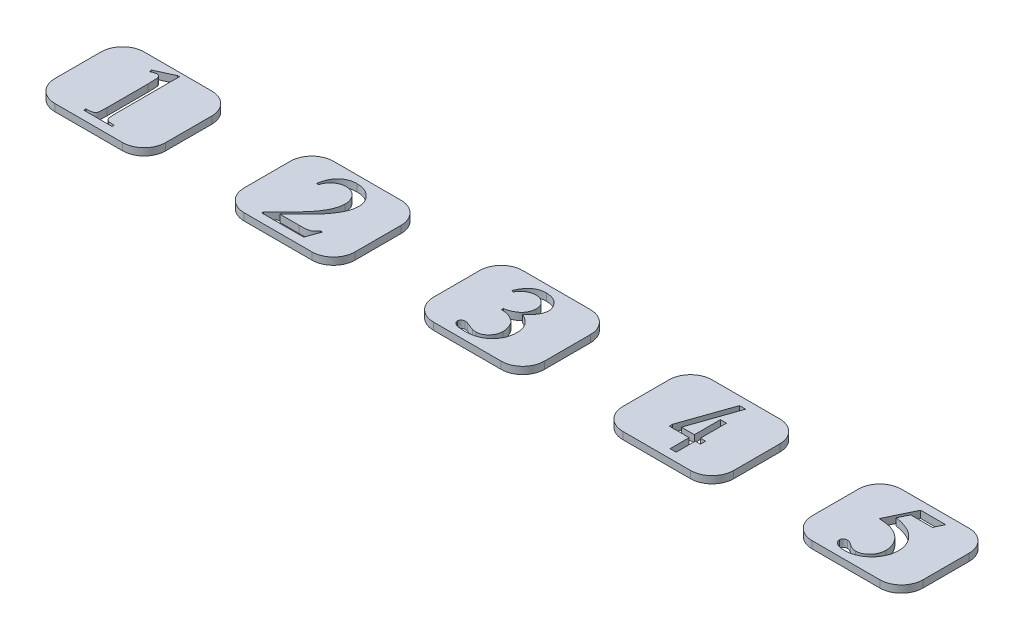
from build123d import *

# Parameters (mm, degrees)
BOSS_EXTRUDE2_DEPTH   = 1
BOSS_EXTRUDE2_2_DEPTH = 1
BOSS_EXTRUDE2_3_DEPTH = 1
BOSS_EXTRUDE2_4_DEPTH = 1
BOSS_EXTRUDE2_5_DEPTH = 1


with BuildPart() as part:
    # Sketch1 → Boss-Extrude2 (new body)
    with BuildSketch(Plane(origin=(0, 0, 0), x_dir=(1, 0, 0), z_dir=(0, 1, 0))):
        with BuildLine():
            Line((-74.96080402, -8.078643216), (-65.56080402, -8.078643216))
            ThreePointArc((-65.56080402, -8.078643216), (-63.439483677, -7.19996356), (-62.56080402, -5.078643216))
            Line((-62.56080402, -5.078643216), (-62.56080402, 1.321356784))
            ThreePointArc((-62.56080402, 1.321356784), (-63.439483677, 3.442677127), (-65.56080402, 4.321356784))
            Line((-65.56080402, 4.321356784), (-74.96080402, 4.321356784))
            ThreePointArc((-74.96080402, 4.321356784), (-77.082124364, 3.442677127), (-77.96080402, 1.321356784))
            Line((-77.96080402, 1.321356784), (-77.96080402, -5.078643216))
            ThreePointArc((-77.96080402, -5.078643216), (-77.082124364, -7.19996356), (-74.96080402, -8.078643216))
        make_face()
        with BuildLine():
            Line((-72.308324749, 2.627703027), (-69.792342246, 3.797714873))
            Line((-69.792342246, 3.797714873), (-69.529546617, 3.797714873))
            Line((-69.529546617, 3.797714873), (-69.529546617, -4.977373967))
            add(Edge.make_bspline(
                [(-69.529546617, -4.977373967), (-69.528639442, -5.049733103), (-69.526920574, -5.186835517), (-69.526703838, -5.38194185), (-69.517803674, -5.554735488), (-69.513462486, -5.706603583), (-69.500013951, -5.836597893), (-69.491105424, -5.94688009), (-69.474275743, -6.035021909), (-69.454746056, -6.124136325), (-69.414499417, -6.215248293), (-69.346230791, -6.309027449), (-69.25802298, -6.3889114), (-69.145749231, -6.461265811), (-68.990148641, -6.512079455), (-68.783962301, -6.551507397), (-68.518513713, -6.576882765), (-68.321500741, -6.582858072), (-68.213283291, -6.586140255)],
                knots=[0, 0, 0, 0, 1.356933168, 2.571048021, 3.657379777, 4.601012336, 5.418253307, 6.107533085, 6.673460353, 7.099554724, 7.815972102, 8.521630774, 9.259509655, 10.036179522, 11.007509208, 12.304408113, 13.970044684, 16, 16, 16, 16], degree=3))
            Line((-68.213283291, -6.586140255), (-68.213283291, -6.878643216))
            Line((-68.213283291, -6.878643216), (-72.162073269, -6.878643216))
            Line((-72.162073269, -6.878643216), (-72.162073269, -6.586140255))
            add(Edge.make_bspline(
                [(-72.162073269, -6.586140255), (-72.051552799, -6.583001689), (-71.851462569, -6.577319517), (-71.584040999, -6.550817446), (-71.380514483, -6.515371461), (-71.230874696, -6.46568854), (-71.127537486, -6.394951472), (-71.043116837, -6.32287718), (-70.978857147, -6.237658714), (-70.932914627, -6.158298943), (-70.906096212, -6.077043022), (-70.892554077, -5.99064429), (-70.875048652, -5.881292871), (-70.865614073, -5.746790602), (-70.856281568, -5.58837629), (-70.849037751, -5.406285901), (-70.848317338, -5.199793469), (-70.846677223, -5.054306439), (-70.845809943, -4.977373967)],
                knots=[0, 0, 0, 0, 2.071302469, 3.74996044, 5.029173581, 5.941282905, 6.673651071, 7.361112001, 8.012044112, 8.663601818, 9.069808009, 9.607263055, 10.29959599, 11.144699654, 12.131164582, 13.273777592, 14.558393644, 16, 16, 16, 16], degree=3))
            Line((-70.845809943, -4.977373967), (-70.845809943, 0.726433779))
            add(Edge.make_bspline(
                [(-70.845809943, 0.726433779), (-70.845299636, 0.811753687), (-70.844324495, 0.974790591), (-70.850923824, 1.207825741), (-70.852962897, 1.417451903), (-70.864247539, 1.602394895), (-70.870822831, 1.763466995), (-70.886446856, 1.899512589), (-70.89739126, 2.013012156), (-70.91228612, 2.079351296), (-70.918935683, 2.108967307)],
                knots=[0, 0, 0, 0, 1.476765178, 2.821934835, 4.035278551, 5.104597693, 6.029081604, 6.824151588, 7.47506195, 8, 8, 8, 8], degree=3))
            add(Edge.make_bspline(
                [(-70.918935683, 2.108967307), (-70.928631652, 2.145841181), (-70.947010792, 2.215737251), (-70.988559686, 2.311685685), (-71.041546853, 2.393307801), (-71.125577228, 2.48035736), (-71.258087261, 2.559098065), (-71.377064486, 2.569728675), (-71.437671404, 2.575143901)],
                knots=[0, 0, 0, 0, 0.903062441, 1.711795068, 2.468214314, 3.196286531, 4.571790261, 6, 6, 6, 6], degree=3))
            add(Edge.make_bspline(
                [(-71.437671404, 2.575143901), (-71.487374299, 2.571084829), (-71.598111764, 2.562041264), (-71.776324334, 2.515792644), (-71.980329143, 2.438388017), (-72.122178925, 2.371339372), (-72.198636139, 2.335200066)],
                knots=[0, 0, 0, 0, 0.743837888, 1.657262055, 2.737261251, 4, 4, 4, 4], degree=3))
            Line((-72.198636139, 2.335200066), (-72.308324749, 2.627703027))
        make_face(mode=Mode.SUBTRACT)
    extrude(amount=BOSS_EXTRUDE2_DEPTH)


with BuildPart() as body_2:
    # Sketch1 → Boss-Extrude2 2 (new body)
    with BuildSketch(Plane(origin=(0, 0, 0), x_dir=(1, 0, 0), z_dir=(0, 1, 0))):
        with BuildLine():
            Line((-51.66080402, -5.078643216), (-51.66080402, 1.321356784))
            ThreePointArc((-51.66080402, 1.321356784), (-50.782124364, 3.442677127), (-48.66080402, 4.321356784))
            Line((-48.66080402, 4.321356784), (-39.26080402, 4.321356784))
            ThreePointArc((-39.26080402, 4.321356784), (-37.139483677, 3.442677127), (-36.26080402, 1.321356784))
            Line((-36.26080402, 1.321356784), (-36.26080402, -5.078643216))
            ThreePointArc((-36.26080402, -5.078643216), (-37.139483677, -7.19996356), (-39.26080402, -8.078643216))
            Line((-39.26080402, -8.078643216), (-48.66080402, -8.078643216))
            ThreePointArc((-48.66080402, -8.078643216), (-50.782124364, -7.19996356), (-51.66080402, -5.078643216))
        make_face()
        with BuildLine():
            Line((-40.905248465, -4.962410577), (-41.59752277, -6.878643216))
            Line((-41.59752277, -6.878643216), (-47.433026242, -6.878643216))
            Line((-47.433026242, -6.878643216), (-47.433026242, -6.607375855))
            add(Edge.make_bspline(
                [(-47.433026242, -6.607375855), (-47.224220422, -6.415466758), (-46.81950697, -6.04350302), (-46.240231981, -5.495670208), (-45.709527892, -4.974370202), (-45.227267723, -4.479807909), (-44.793007981, -4.012319636), (-44.407773514, -3.570431568), (-44.068395958, -3.158019396), (-43.776449934, -2.7672969), (-43.522816024, -2.395751259), (-43.307961281, -2.032730665), (-43.124741566, -1.678666397), (-42.972868986, -1.332978504), (-42.85765504, -0.993627039), (-42.774540755, -0.66278739), (-42.721800511, -0.340251194), (-42.714423057, -0.127527059), (-42.71080402, -0.023174466)],
                knots=[0, 0, 0, 0, 1.640196139, 3.179075376, 4.61094688, 5.942305235, 7.173872596, 8.30065911, 9.332401675, 10.262017718, 11.120692698, 11.932909408, 12.700076558, 13.425218913, 14.114511764, 14.770003029, 15.396620544, 16, 16, 16, 16], degree=3))
            add(Edge.make_bspline(
                [(-42.71080402, -0.023174466), (-42.712205255, 0.054320366), (-42.714952112, 0.206234368), (-42.744335962, 0.428395354), (-42.790089859, 0.640284581), (-42.851521342, 0.842565972), (-42.936253907, 1.032656577), (-43.034555678, 1.213881851), (-43.156519504, 1.381499885), (-43.291580044, 1.539013289), (-43.440238319, 1.681073834), (-43.597599456, 1.805388151), (-43.760815771, 1.913157007), (-43.932365095, 2.000550709), (-44.112220617, 2.065285429), (-44.298150926, 2.113115918), (-44.491366931, 2.145420083), (-44.623288492, 2.147887407), (-44.689970687, 2.149134562)],
                knots=[0, 0, 0, 0, 1.134419306, 2.223815103, 3.275304008, 4.307399035, 5.313221346, 6.318597171, 7.32112197, 8.342723066, 9.354331769, 10.327252885, 11.276405737, 12.214555788, 13.139633085, 14.069852934, 15.024371439, 16, 16, 16, 16], degree=3))
            add(Edge.make_bspline(
                [(-44.689970687, 2.149134562), (-44.810534357, 2.1445343), (-45.04794394, 2.135475632), (-45.392956626, 2.051343155), (-45.719090244, 1.917577053), (-46.023015813, 1.730627488), (-46.298518793, 1.492326812), (-46.538203478, 1.203414977), (-46.737360737, 0.863562473), (-46.832657598, 0.612146344), (-46.881810965, 0.482467895)],
                knots=[0, 0, 0, 0, 0.978774112, 1.927366301, 2.868767021, 3.835023234, 4.81480387, 5.817007219, 6.874029602, 8, 8, 8, 8], degree=3))
            Line((-46.881810965, 0.482467895), (-47.155248465, 0.482467895))
            add(Edge.make_bspline(
                [(-47.155248465, 0.482467895), (-47.138855066, 0.591297797), (-47.10682587, 0.803928157), (-47.031468699, 1.110269647), (-46.941799672, 1.398385328), (-46.829904036, 1.665266903), (-46.704343752, 1.915371446), (-46.559173895, 2.145166365), (-46.395459294, 2.355858479), (-46.212240735, 2.544159195), (-46.01594577, 2.713551146), (-45.805885571, 2.859239199), (-45.58548101, 2.985490092), (-45.350692221, 3.083429154), (-45.105553165, 3.16309554), (-44.848893875, 3.218434479), (-44.580345723, 3.25499771), (-44.39712684, 3.258473191), (-44.303685965, 3.260245673)],
                knots=[0, 0, 0, 0, 1.200501633, 2.345523519, 3.439068721, 4.490246694, 5.499995932, 6.48995494, 7.451685612, 8.406391985, 9.352574024, 10.27676432, 11.192316343, 12.119031984, 13.047762957, 14.001652993, 14.980851257, 16, 16, 16, 16], degree=3))
            add(Edge.make_bspline(
                [(-44.303685965, 3.260245673), (-44.2044959, 3.257440342), (-44.009846549, 3.251935197), (-43.723323583, 3.217550963), (-43.449626089, 3.156266501), (-43.187177499, 3.072401383), (-42.939729674, 2.959992586), (-42.702757719, 2.828024925), (-42.480908688, 2.667473272), (-42.272937599, 2.486994362), (-42.08186252, 2.291346741), (-41.917902309, 2.081735569), (-41.773408863, 1.866945011), (-41.661947653, 1.639506264), (-41.571345421, 1.40524857), (-41.505836516, 1.162534762), (-41.468631903, 0.909692924), (-41.463441856, 0.738664018), (-41.46080402, 0.651738728)],
                knots=[0, 0, 0, 0, 1.109419983, 2.177111989, 3.221343547, 4.242152537, 5.252521162, 6.255999647, 7.270763728, 8.308866099, 9.333003754, 10.32358272, 11.281716678, 12.222409134, 13.149434629, 14.0874794, 15.027963099, 16, 16, 16, 16], degree=3))
            add(Edge.make_bspline(
                [(-41.46080402, 0.651738728), (-41.464815138, 0.525553897), (-41.472893824, 0.271408391), (-41.544492415, -0.107483559), (-41.653988947, -0.487442877), (-41.761693574, -0.731730763), (-41.816706798, -0.856507799)],
                knots=[0, 0, 0, 0, 0.968670703, 1.950973842, 2.953401185, 4, 4, 4, 4], degree=3))
            add(Edge.make_bspline(
                [(-41.816706798, -0.856507799), (-41.864574074, -0.95702415), (-41.962187028, -1.162001299), (-42.137063481, -1.462936442), (-42.327225083, -1.771074326), (-42.538128114, -2.084702628), (-42.772347639, -2.400865913), (-43.030377089, -2.719427428), (-43.304824778, -3.04607429), (-43.500666392, -3.260271346), (-43.600560965, -3.369528633)],
                knots=[0, 0, 0, 0, 0.863272392, 1.760421205, 2.69783519, 3.672094839, 4.691137575, 5.748887515, 6.851756197, 8, 8, 8, 8], degree=3))
            add(Edge.make_bspline(
                [(-43.600560965, -3.369528633), (-43.748037214, -3.521528521), (-44.028734429, -3.810835752), (-44.429841837, -4.221364976), (-44.791797598, -4.58570382), (-45.109021342, -4.910106866), (-45.389034378, -5.186386453), (-45.626029417, -5.420343867), (-45.822995296, -5.608977427), (-45.942021366, -5.71919331), (-45.994224159, -5.767532105)],
                knots=[0, 0, 0, 0, 1.500005584, 2.855018295, 4.065062351, 5.137441976, 6.068514136, 6.851077111, 7.496102131, 8, 8, 8, 8], degree=3))
            Line((-45.994224159, -5.767532105), (-43.353165131, -5.767532105))
            add(Edge.make_bspline(
                [(-43.353165131, -5.767532105), (-43.228731932, -5.766705265), (-43.000066366, -5.765185818), (-42.687452036, -5.754516858), (-42.435241517, -5.739378403), (-42.234065513, -5.71361016), (-42.066146292, -5.674965896), (-41.915068527, -5.622953508), (-41.771012558, -5.557409081), (-41.635959432, -5.473791217), (-41.507362819, -5.374624366), (-41.389419404, -5.254539494), (-41.277416652, -5.118573967), (-41.215037279, -5.015370958), (-41.183026242, -4.962410577)],
                knots=[0, 0, 0, 0, 1.823242483, 3.350494689, 4.582960761, 5.524351838, 6.318821823, 7.103187077, 7.861997978, 8.632781373, 9.425765109, 10.235225094, 11.094375721, 12, 12, 12, 12], degree=3))
            Line((-41.183026242, -4.962410577), (-40.905248465, -4.962410577))
        make_face(mode=Mode.SUBTRACT)
    extrude(amount=BOSS_EXTRUDE2_2_DEPTH)


with BuildPart() as body_3:
    # Sketch1 → Boss-Extrude2 3 (new body)
    with BuildSketch(Plane(origin=(0, 0, 0), x_dir=(1, 0, 0), z_dir=(0, 1, 0))):
        with BuildLine():
            Line((-25.36080402, -5.078643216), (-25.36080402, 1.321356784))
            ThreePointArc((-25.36080402, 1.321356784), (-24.482124364, 3.442677127), (-22.36080402, 4.321356784))
            Line((-22.36080402, 4.321356784), (-12.96080402, 4.321356784))
            ThreePointArc((-12.96080402, 4.321356784), (-10.839483677, 3.442677127), (-9.96080402, 1.321356784))
            Line((-9.96080402, 1.321356784), (-9.96080402, -5.078643216))
            ThreePointArc((-9.96080402, -5.078643216), (-10.839483677, -7.19996356), (-12.96080402, -8.078643216))
            Line((-12.96080402, -8.078643216), (-22.36080402, -8.078643216))
            ThreePointArc((-22.36080402, -8.078643216), (-24.482124364, -7.19996356), (-25.36080402, -5.078643216))
        make_face()
        with BuildLine():
            add(Edge.make_bspline(
                [(-20.716359576, 1.176912339), (-20.680066429, 1.258204132), (-20.609086512, 1.417189651), (-20.494557677, 1.646450715), (-20.369468306, 1.860223857), (-20.238797183, 2.060488973), (-20.1006573, 2.246323546), (-19.958229963, 2.419002194), (-19.805151637, 2.574932515), (-19.646903129, 2.719117716), (-19.480178905, 2.84886294), (-19.300405604, 2.956582909), (-19.112758718, 3.050805644), (-18.915740194, 3.129460108), (-18.707565368, 3.188055864), (-18.490261287, 3.228092577), (-18.263357015, 3.255718655), (-18.108661468, 3.258716178), (-18.029727631, 3.260245673)],
                knots=[0, 0, 0, 0, 1.176091227, 2.300127321, 3.3835767, 4.446473798, 5.457585235, 6.441364894, 7.401036819, 8.341531155, 9.268576939, 10.186414906, 11.105297085, 12.040532869, 12.984371496, 13.957134865, 14.957622323, 16, 16, 16, 16], degree=3))
            add(Edge.make_bspline(
                [(-18.029727631, 3.260245673), (-17.933434119, 3.257422177), (-17.745276043, 3.25190505), (-17.471512646, 3.218428249), (-17.215015728, 3.156621331), (-16.975892062, 3.072777594), (-16.753463806, 2.96389853), (-16.551827768, 2.826685359), (-16.361388819, 2.672027808), (-16.25427946, 2.548007471), (-16.200300548, 2.485506089)],
                knots=[0, 0, 0, 0, 1.123808988, 2.195929207, 3.211426243, 4.196579678, 5.14788152, 6.09136163, 7.038121192, 8, 8, 8, 8], degree=3))
            add(Edge.make_bspline(
                [(-16.200300548, 2.485506089), (-16.125718365, 2.390234804), (-15.981756457, 2.206337856), (-15.830900607, 1.897071566), (-15.733809043, 1.579201207), (-15.72215922, 1.361330182), (-15.716359576, 1.252867201)],
                knots=[0, 0, 0, 0, 1.071729872, 2.068701529, 3.038539469, 4, 4, 4, 4], degree=3))
            add(Edge.make_bspline(
                [(-15.716359576, 1.252867201), (-15.720652991, 1.162068313), (-15.729380981, 0.977485284), (-15.798754222, 0.701239939), (-15.908632244, 0.423635027), (-16.062892938, 0.14452776), (-16.260961791, -0.136185609), (-16.500242044, -0.420274412), (-16.784093156, -0.705373089), (-16.995401418, -0.886202747), (-17.105248465, -0.980205716)],
                knots=[0, 0, 0, 0, 0.802544778, 1.631475345, 2.504987027, 3.438672434, 4.445331875, 5.540090885, 6.721234327, 8, 8, 8, 8], degree=3))
            add(Edge.make_bspline(
                [(-17.105248465, -0.980205716), (-17.032433495, -1.010249285), (-16.889610736, -1.069178176), (-16.686774955, -1.174325643), (-16.498823314, -1.290013579), (-16.321305017, -1.410403372), (-16.160013497, -1.54404355), (-16.012445457, -1.687421404), (-15.877531032, -1.839767378), (-15.755331925, -2.000166375), (-15.648800218, -2.170636812), (-15.556027508, -2.348703705), (-15.474332061, -2.532719404), (-15.412080944, -2.725915484), (-15.362293221, -2.92534743), (-15.325106815, -3.131855255), (-15.30280196, -3.345883486), (-15.300741367, -3.49100256), (-15.299692909, -3.564841133)],
                knots=[0, 0, 0, 0, 1.121628463, 2.200015641, 3.249715177, 4.264389965, 5.252559056, 6.229000805, 7.192526379, 8.148751574, 9.09789992, 10.051957494, 11.00718286, 11.961907919, 12.939056191, 13.933490933, 14.948531889, 16, 16, 16, 16], degree=3))
            add(Edge.make_bspline(
                [(-15.299692909, -3.564841133), (-15.302269066, -3.670565348), (-15.307331559, -3.8783275), (-15.345180703, -4.18479655), (-15.407082426, -4.480030878), (-15.497885752, -4.764076547), (-15.610014983, -5.038683397), (-15.750077108, -5.30214376), (-15.91493969, -5.555069355), (-16.042611699, -5.712185083), (-16.106984576, -5.791403633)],
                knots=[0, 0, 0, 0, 1.048019005, 2.059496798, 3.056839529, 4.034491814, 5.012117791, 5.993865523, 6.98849678, 8, 8, 8, 8], degree=3))
            add(Edge.make_bspline(
                [(-16.106984576, -5.791403633), (-16.197243561, -5.889305427), (-16.377200475, -6.084500452), (-16.688625935, -6.333877047), (-17.027671846, -6.545639372), (-17.395522111, -6.721297483), (-17.7944175, -6.854775308), (-18.222067505, -6.949713666), (-18.678514317, -7.006586741), (-18.992379408, -7.013813841), (-19.153859576, -7.017532105)],
                knots=[0, 0, 0, 0, 0.9408645, 1.875880513, 2.811526398, 3.763677692, 4.752375993, 5.780273647, 6.857974994, 8, 8, 8, 8], degree=3))
            add(Edge.make_bspline(
                [(-19.153859576, -7.017532105), (-19.232722302, -7.01661943), (-19.384014343, -7.014868535), (-19.601161133, -7.003880358), (-19.79898051, -6.987463835), (-19.977492916, -6.962293394), (-20.13571916, -6.926616659), (-20.275880188, -6.889193178), (-20.396744496, -6.842211764), (-20.523865838, -6.76869993), (-20.652815106, -6.672674748), (-20.765708879, -6.54557904), (-20.842254349, -6.413842215), (-20.851027134, -6.320337604), (-20.855248465, -6.275344605)],
                knots=[0, 0, 0, 0, 1.402226433, 2.690062984, 3.865046374, 4.930988681, 5.892224942, 6.747350114, 7.509271635, 8.188907461, 9.354277059, 10.347676201, 11.204926872, 12, 12, 12, 12], degree=3))
            add(Edge.make_bspline(
                [(-20.855248465, -6.275344605), (-20.853084775, -6.242538466), (-20.848805425, -6.177654406), (-20.816359811, -6.083505466), (-20.763947002, -5.995511338), (-20.688750816, -5.9188804), (-20.602089808, -5.851362359), (-20.502549119, -5.804352828), (-20.396596783, -5.77089413), (-20.322388377, -5.768668421), (-20.284501937, -5.767532105)],
                knots=[0, 0, 0, 0, 0.930288779, 1.839927393, 2.798379237, 3.815801145, 4.871906534, 5.901086166, 6.928418261, 8, 8, 8, 8], degree=3))
            add(Edge.make_bspline(
                [(-20.284501937, -5.767532105), (-20.224202132, -5.7691467), (-20.101040527, -5.772444489), (-19.981124075, -5.800801642), (-19.919918603, -5.815275161)],
                knots=[0, 0, 0, 0, 0.9791981, 2, 2, 2, 2], degree=3))
            add(Edge.make_bspline(
                [(-19.919918603, -5.815275161), (-19.893090163, -5.823767187), (-19.826544102, -5.844831062), (-19.708315553, -5.889216829), (-19.552723224, -5.955310672), (-19.370250013, -6.034669705), (-19.185399644, -6.115408846), (-19.021005115, -6.180190033), (-18.889646942, -6.228025875), (-18.811826911, -6.248986796), (-18.778425548, -6.257983494)],
                knots=[0, 0, 0, 0, 0.551098561, 1.366961252, 2.47206847, 3.861764831, 5.264472469, 6.422097681, 7.322743916, 8, 8, 8, 8], degree=3))
            add(Edge.make_bspline(
                [(-18.778425548, -6.257983494), (-18.688301151, -6.276435389), (-18.50285644, -6.314402982), (-18.313625862, -6.320139194), (-18.216359576, -6.323087661)],
                knots=[0, 0, 0, 0, 0.971981303, 2, 2, 2, 2], degree=3))
            add(Edge.make_bspline(
                [(-18.216359576, -6.323087661), (-18.156179704, -6.321730419), (-18.037302406, -6.319049369), (-17.863232016, -6.288368794), (-17.694458652, -6.246489921), (-17.532200788, -6.182287782), (-17.376903538, -6.099082323), (-17.225086323, -6.001467349), (-17.082255627, -5.882984395), (-16.946349953, -5.749475324), (-16.822248698, -5.602967565), (-16.710112148, -5.449851747), (-16.619406069, -5.287133113), (-16.542140938, -5.120045073), (-16.48436107, -4.94503172), (-16.439442704, -4.764708127), (-16.416406533, -4.576723446), (-16.412688369, -4.449586221), (-16.41080402, -4.385153633)],
                knots=[0, 0, 0, 0, 0.98287937, 1.941546881, 2.88253887, 3.822638359, 4.785601421, 5.759974566, 6.768635762, 7.814143594, 8.871295523, 9.905298752, 10.911738224, 11.912182368, 12.910876931, 13.920716429, 14.946228209, 16, 16, 16, 16], degree=3))
            add(Edge.make_bspline(
                [(-16.41080402, -4.385153633), (-16.413624787, -4.289460122), (-16.419255646, -4.098435245), (-16.467983207, -3.815257372), (-16.539613164, -3.534028922), (-16.613990381, -3.354293204), (-16.651689437, -3.263191827)],
                knots=[0, 0, 0, 0, 0.993065039, 1.982371906, 2.977339071, 4, 4, 4, 4], degree=3))
            add(Edge.make_bspline(
                [(-16.651689437, -3.263191827), (-16.680840248, -3.198884262), (-16.736653436, -3.075758695), (-16.835890841, -2.909808021), (-16.933003901, -2.762951263), (-17.010031916, -2.682806766), (-17.046654715, -2.644702244)],
                knots=[0, 0, 0, 0, 1.146959708, 2.196010144, 3.142297047, 4, 4, 4, 4], degree=3))
            add(Edge.make_bspline(
                [(-17.046654715, -2.644702244), (-17.099150713, -2.595713682), (-17.208944696, -2.493255409), (-17.401376856, -2.358929073), (-17.620105067, -2.23054226), (-17.861108043, -2.111193176), (-18.11611464, -2.007321084), (-18.380050344, -1.932269968), (-18.646723976, -1.88820444), (-18.826012431, -1.881818124), (-18.915144298, -1.878643216)],
                knots=[0, 0, 0, 0, 0.833783525, 1.743836022, 2.720158816, 3.780630828, 4.867413274, 5.916185896, 6.964047963, 8, 8, 8, 8], degree=3))
            Line((-18.915144298, -1.878643216), (-19.136498465, -1.878643216))
            Line((-19.136498465, -1.878643216), (-19.136498465, -1.600865438))
            add(Edge.make_bspline(
                [(-19.136498465, -1.600865438), (-19.037686931, -1.58561717), (-18.83764545, -1.55474743), (-18.540736813, -1.468070339), (-18.245527809, -1.346838985), (-17.954615867, -1.200287848), (-17.681857674, -1.028660212), (-17.445048661, -0.833754619), (-17.246572225, -0.622753857), (-17.092207171, -0.392958954), (-16.974083983, -0.149102464), (-16.888807778, 0.106022046), (-16.837704947, 0.373378777), (-16.830910059, 0.555310136), (-16.827470687, 0.647398451)],
                knots=[0, 0, 0, 0, 1.018822759, 2.062581231, 3.144841569, 4.269905924, 5.381171259, 6.423990724, 7.389747841, 8.324839968, 9.23548737, 10.145327579, 11.061219247, 12, 12, 12, 12], degree=3))
            add(Edge.make_bspline(
                [(-16.827470687, 0.647398451), (-16.82827861, 0.706818324), (-16.829871882, 0.823997808), (-16.855563096, 0.994398935), (-16.891120006, 1.157924153), (-16.946338438, 1.310686366), (-17.012941344, 1.456810025), (-17.100001952, 1.590698016), (-17.196020942, 1.720868798), (-17.312297522, 1.835381454), (-17.434587876, 1.942889444), (-17.568481093, 2.03429797), (-17.709255089, 2.111480778), (-17.856342516, 2.178919747), (-18.011851384, 2.227606723), (-18.174644741, 2.262263962), (-18.344472605, 2.285095475), (-18.460785915, 2.287033723), (-18.52017902, 2.288023451)],
                knots=[0, 0, 0, 0, 1.07791789, 2.125717433, 3.123144222, 4.111969722, 5.069857656, 6.032059613, 7.006823601, 8.000784083, 8.988212443, 9.96111577, 10.93720663, 11.90155836, 12.894476591, 13.889044549, 14.92208211, 16, 16, 16, 16], degree=3))
            add(Edge.make_bspline(
                [(-18.52017902, 2.288023451), (-18.615191208, 2.284107415), (-18.803295047, 2.276354501), (-19.080420644, 2.219095671), (-19.343444554, 2.119160288), (-19.597282302, 1.986691554), (-19.834105586, 1.80930386), (-20.061110709, 1.596930539), (-20.27741774, 1.346443911), (-20.403701349, 1.157414025), (-20.468963742, 1.059724839)],
                knots=[0, 0, 0, 0, 0.945780098, 1.8724426, 2.802290766, 3.739917435, 4.713776979, 5.738108685, 6.831072039, 8, 8, 8, 8], degree=3))
            Line((-20.468963742, 1.059724839), (-20.716359576, 1.176912339))
        make_face(mode=Mode.SUBTRACT)
    extrude(amount=BOSS_EXTRUDE2_3_DEPTH)


with BuildPart() as body_4:
    # Sketch1 → Boss-Extrude2 4 (new body)
    with BuildSketch(Plane(origin=(0, 0, 0), x_dir=(1, 0, 0), z_dir=(0, 1, 0))):
        with BuildLine():
            Line((0.93919598, -5.078643216), (0.93919598, 1.321356784))
            ThreePointArc((0.93919598, 1.321356784), (1.817875636, 3.442677127), (3.93919598, 4.321356784))
            Line((3.93919598, 4.321356784), (13.33919598, 4.321356784))
            ThreePointArc((13.33919598, 4.321356784), (15.460516323, 3.442677127), (16.33919598, 1.321356784))
            Line((16.33919598, 1.321356784), (16.33919598, -5.078643216))
            ThreePointArc((16.33919598, -5.078643216), (15.460516323, -7.19996356), (13.33919598, -8.078643216))
            Line((13.33919598, -8.078643216), (3.93919598, -8.078643216))
            ThreePointArc((3.93919598, -8.078643216), (1.817875636, -7.19996356), (0.93919598, -5.078643216))
        make_face()
        with BuildLine():
            Line((10.868111643, -4.228040806), (10.145220076, -4.228040806))
            Line((10.145220076, -4.228040806), (10.145220076, -6.878643216))
            Line((10.145220076, -6.878643216), (9.301846582, -6.878643216))
            Line((9.301846582, -6.878643216), (9.301846582, -4.228040806))
            Line((9.301846582, -4.228040806), (6.530762245, -4.228040806))
            Line((6.530762245, -4.228040806), (6.530762245, -3.776233578))
            Line((6.530762245, -3.776233578), (8.938518269, 3.121356784))
            Line((8.938518269, 3.121356784), (9.781891763, 3.121356784))
            add(Edge.make_bspline(
                [(9.781891763, 3.121356784), (9.781891763, 3.111944133), (9.781891763, 3.099393933), (9.781891763, 3.086843732), (9.781891763, 3.083706182)],
                knots=[0, 0, 0, 0, 1.5, 2, 2, 2, 2], degree=3))
            Line((9.781891763, 3.083706182), (7.494617667, -3.50514924))
            Line((7.494617667, -3.50514924), (9.301846582, -3.50514924))
            Line((9.301846582, -3.50514924), (9.301846582, 0.109308591))
            Line((9.301846582, 0.109308591), (10.145220076, 0.109308591))
            Line((10.145220076, 0.109308591), (10.145220076, -3.50514924))
            Line((10.145220076, -3.50514924), (10.868111643, -3.50514924))
            Line((10.868111643, -3.50514924), (10.868111643, -4.228040806))
        make_face(mode=Mode.SUBTRACT)
    extrude(amount=BOSS_EXTRUDE2_4_DEPTH)


with BuildPart() as body_5:
    # Sketch1 → Boss-Extrude2 5 (new body)
    with BuildSketch(Plane(origin=(0, 0, 0), x_dir=(1, 0, 0), z_dir=(0, 1, 0))):
        with BuildLine():
            Line((27.23919598, -5.078643216), (27.23919598, 1.321356784))
            ThreePointArc((27.23919598, 1.321356784), (28.117875636, 3.442677127), (30.23919598, 4.321356784))
            Line((30.23919598, 4.321356784), (39.63919598, 4.321356784))
            ThreePointArc((39.63919598, 4.321356784), (41.760516323, 3.442677127), (42.63919598, 1.321356784))
            Line((42.63919598, 1.321356784), (42.63919598, -5.078643216))
            ThreePointArc((42.63919598, -5.078643216), (41.760516323, -7.19996356), (39.63919598, -8.078643216))
            Line((39.63919598, -8.078643216), (30.23919598, -8.078643216))
            ThreePointArc((30.23919598, -8.078643216), (28.117875636, -7.19996356), (27.23919598, -5.078643216))
        make_face()
        with BuildLine():
            Line((37.578084869, 3.121356784), (37.000827924, 1.871356784))
            Line((37.000827924, 1.871356784), (33.984334869, 1.871356784))
            Line((33.984334869, 1.871356784), (33.313761952, 0.508509562))
            add(Edge.make_bspline(
                [(33.313761952, 0.508509562), (33.484919368, 0.482693214), (33.819225904, 0.432268442), (34.300525334, 0.31848786), (34.750675401, 0.180041187), (35.168215738, 0.014138432), (35.552510906, -0.182700697), (35.905103107, -0.404233643), (36.228516872, -0.650847661), (36.416907971, -0.84052572), (36.510376535, -0.934632799)],
                knots=[0, 0, 0, 0, 1.161098856, 2.267870976, 3.314957367, 4.319094488, 5.278631444, 6.207879786, 7.110855526, 8, 8, 8, 8], degree=3))
            add(Edge.make_bspline(
                [(36.510376535, -0.934632799), (36.584337036, -1.017955171), (36.730302703, -1.182397078), (36.918767364, -1.449178946), (37.081822919, -1.725423265), (37.210767815, -2.015203027), (37.315196989, -2.314517038), (37.385041172, -2.625521721), (37.430497898, -2.947185005), (37.436265974, -3.165377542), (37.43919598, -3.276212661)],
                knots=[0, 0, 0, 0, 1.034913379, 2.042466206, 3.030809393, 4.011898082, 4.985794297, 5.972603802, 6.970144889, 8, 8, 8, 8], degree=3))
            add(Edge.make_bspline(
                [(37.43919598, -3.276212661), (37.43539608, -3.404463459), (37.427908885, -3.657164523), (37.36986105, -4.029060325), (37.275134008, -4.386836461), (37.13891111, -4.726240056), (36.976749113, -5.045517018), (36.794041662, -5.343159799), (36.589350691, -5.615167775), (36.365366303, -5.862524634), (36.126203178, -6.086402989), (35.873474499, -6.287547991), (35.606248317, -6.463689044), (35.418877965, -6.563923209), (35.325480702, -6.613886272)],
                knots=[0, 0, 0, 0, 1.1099864, 2.187079908, 3.250539699, 4.307729047, 5.34688064, 6.348023694, 7.327560577, 8.289805641, 9.233611556, 10.160876763, 11.083264383, 12, 12, 12, 12], degree=3))
            add(Edge.make_bspline(
                [(35.325480702, -6.613886272), (35.190757216, -6.675744234), (34.92529299, -6.797631491), (34.508719438, -6.922280186), (34.087954977, -7.00208776), (33.804566577, -7.012390823), (33.663154313, -7.017532105)],
                knots=[0, 0, 0, 0, 1.030129172, 2.029805285, 3.016862743, 4, 4, 4, 4], degree=3))
            add(Edge.make_bspline(
                [(33.663154313, -7.017532105), (33.593659693, -7.017098634), (33.460274313, -7.016266645), (33.267189729, -6.998778663), (33.088351859, -6.979977933), (32.924191748, -6.945781579), (32.774225013, -6.907176726), (32.640852023, -6.852088406), (32.518202626, -6.796857637), (32.383647633, -6.703950297), (32.242562452, -6.582285143), (32.117951957, -6.41914785), (32.035949955, -6.247043565), (32.026958986, -6.126433475), (32.022529313, -6.067011272)],
                knots=[0, 0, 0, 0, 1.193262804, 2.290304112, 3.329214677, 4.279706917, 5.169093206, 5.983709925, 6.756293359, 7.473199502, 8.784894099, 9.938141948, 10.984163348, 12, 12, 12, 12], degree=3))
            add(Edge.make_bspline(
                [(32.022529313, -6.067011272), (32.024739976, -6.034238277), (32.029112229, -5.969419768), (32.060661547, -5.875372825), (32.115383555, -5.789754769), (32.185882459, -5.709766886), (32.274189945, -5.642671176), (32.375864213, -5.595556926), (32.487036647, -5.562227608), (32.565521792, -5.560234328), (32.606296674, -5.559198772)],
                knots=[0, 0, 0, 0, 0.916128209, 1.811920583, 2.738491236, 3.74165137, 4.781681047, 5.813410906, 6.864015437, 8, 8, 8, 8], degree=3))
            add(Edge.make_bspline(
                [(32.606296674, -5.559198772), (32.665212106, -5.561779642), (32.776186472, -5.566641023), (32.913266498, -5.606520143), (33.024533679, -5.661086069), (33.132946069, -5.721935257), (33.264412563, -5.80757655), (33.359497051, -5.872913635), (33.411418202, -5.908591133)],
                knots=[0, 0, 0, 0, 1.184038934, 2.230281013, 2.842640406, 3.677218206, 4.731638514, 6, 6, 6, 6], degree=3))
            add(Edge.make_bspline(
                [(33.411418202, -5.908591133), (33.497680492, -5.965743066), (33.665494413, -6.07692595), (33.931442284, -6.203171156), (34.199439657, -6.289904135), (34.380907238, -6.312124038), (34.47044598, -6.323087661)],
                knots=[0, 0, 0, 0, 1.077967054, 2.097067893, 3.06106564, 4, 4, 4, 4], degree=3))
            add(Edge.make_bspline(
                [(34.47044598, -6.323087661), (34.537117812, -6.320877362), (34.669699217, -6.316482036), (34.864568336, -6.285156523), (35.054640619, -6.235994273), (35.235762938, -6.160138261), (35.413861958, -6.069805955), (35.583018216, -5.954546591), (35.749120538, -5.823199431), (35.903243081, -5.66848079), (36.047284027, -5.502966887), (36.172420531, -5.324448929), (36.279095157, -5.137991673), (36.366205176, -4.941650328), (36.434011114, -4.736661732), (36.480844227, -4.522052747), (36.513184712, -4.299329897), (36.515644563, -4.147279249), (36.516886952, -4.070483494)],
                knots=[0, 0, 0, 0, 0.947900043, 1.884962737, 2.800832902, 3.733139476, 4.671838567, 5.636287641, 6.638887168, 7.679204741, 8.737077399, 9.75606472, 10.774376646, 11.787634885, 12.805946811, 13.839271517, 14.908687479, 16, 16, 16, 16], degree=3))
            add(Edge.make_bspline(
                [(36.516886952, -4.070483494), (36.515208254, -3.99518239), (36.511873012, -3.845573883), (36.485310703, -3.622563415), (36.439758927, -3.404167147), (36.375992897, -3.189538244), (36.295212533, -2.978564986), (36.198242003, -2.770592909), (36.081605294, -2.567028804), (35.948323341, -2.368847412), (35.797670081, -2.179144227), (35.638374608, -1.995083395), (35.460890415, -1.825670968), (35.270677325, -1.667872388), (35.066453408, -1.521442502), (34.850434959, -1.384756505), (34.619489268, -1.26070295), (34.458604637, -1.188308455), (34.377130008, -1.151646688)],
                knots=[0, 0, 0, 0, 0.942313198, 1.872191274, 2.806203531, 3.731530393, 4.671491833, 5.631430359, 6.600590081, 7.605054811, 8.617526285, 9.631090202, 10.649213475, 11.684423761, 12.72220443, 13.792302564, 14.88198562, 16, 16, 16, 16], degree=3))
            add(Edge.make_bspline(
                [(34.377130008, -1.151646688), (34.308721863, -1.124721736), (34.168330372, -1.069464656), (33.944557705, -1.001103739), (33.704667946, -0.937327144), (33.44496511, -0.886237241), (33.168363929, -0.843270656), (32.873749802, -0.808612081), (32.56178754, -0.782540722), (32.347368747, -0.772620913), (32.237373063, -0.767532105)],
                knots=[0, 0, 0, 0, 0.807230533, 1.656649213, 2.568235188, 3.532821807, 4.562222431, 5.642410622, 6.790569369, 8, 8, 8, 8], degree=3))
            Line((32.237373063, -0.767532105), (34.09935223, 3.121356784))
            Line((34.09935223, 3.121356784), (37.578084869, 3.121356784))
        make_face(mode=Mode.SUBTRACT)
    extrude(amount=BOSS_EXTRUDE2_5_DEPTH)


solid = Compound([part.part, body_2.part, body_3.part, body_4.part, body_5.part])
